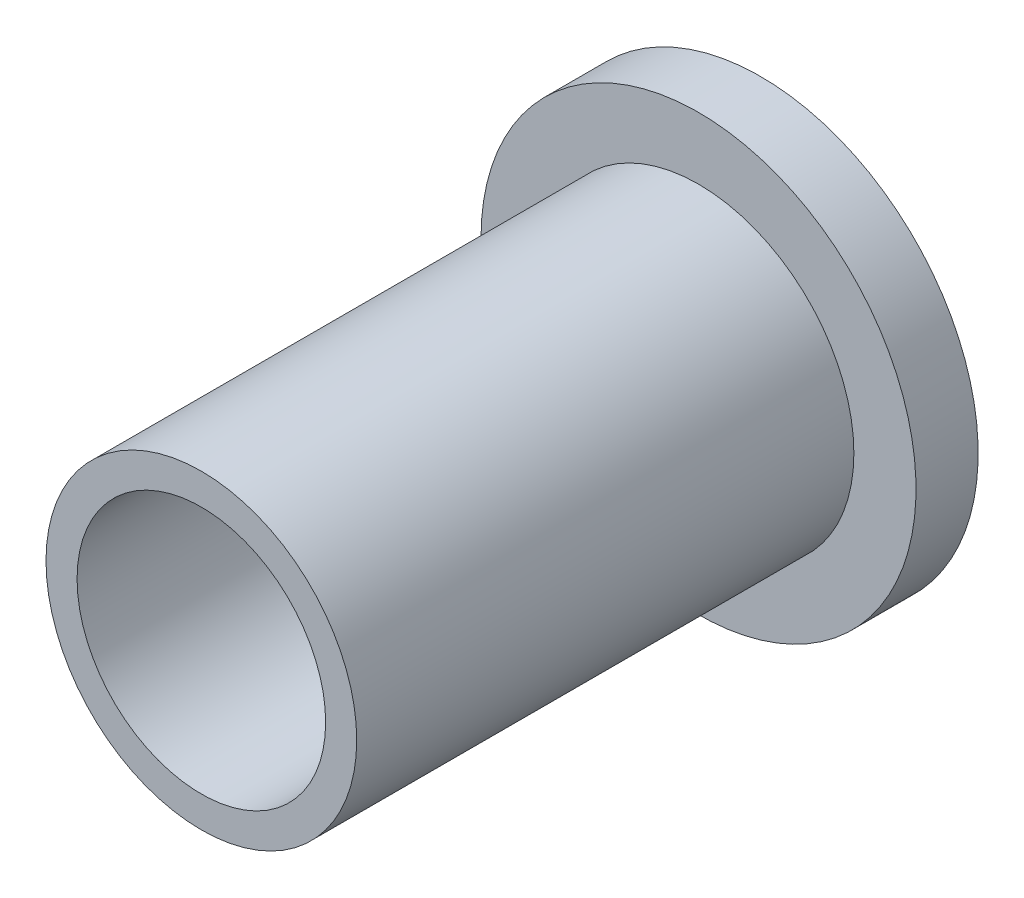
from build123d import *
from build123d.topology import SkipClean

# Parameters (mm, degrees)
SKETCH1_R           = 7.9375
SKETCH1_R_2         = 6.35
BOSS_EXTRUDE1_DEPTH = 25.4
BOSS_EXTRUDE2_START = 3.175
SKETCH2_R           = 11.1125
SKETCH2_R_2         = 6.35
BOSS_EXTRUDE2_DEPTH = 3.175


with BuildPart() as part:
    # Sketch1 → Boss-Extrude1 (new body)
    with BuildSketch(Plane.XY):
        Circle(SKETCH1_R)
        Circle(SKETCH1_R_2, mode=Mode.SUBTRACT)
    extrude(amount=BOSS_EXTRUDE1_DEPTH)

    # Sketch2 → Boss-Extrude2 (add)
    with SkipClean():  # the faces are left unmerged after this step: merging them gives an invalid solid
        with BuildSketch(Plane(origin=(0, 0, 0), x_dir=(-1, 0, 0), z_dir=(0, 0, -1)).offset(BOSS_EXTRUDE2_START)):
            Circle(SKETCH2_R)
            Circle(SKETCH2_R_2, mode=Mode.SUBTRACT)
        extrude(amount=-BOSS_EXTRUDE2_DEPTH)


solid = part.part
